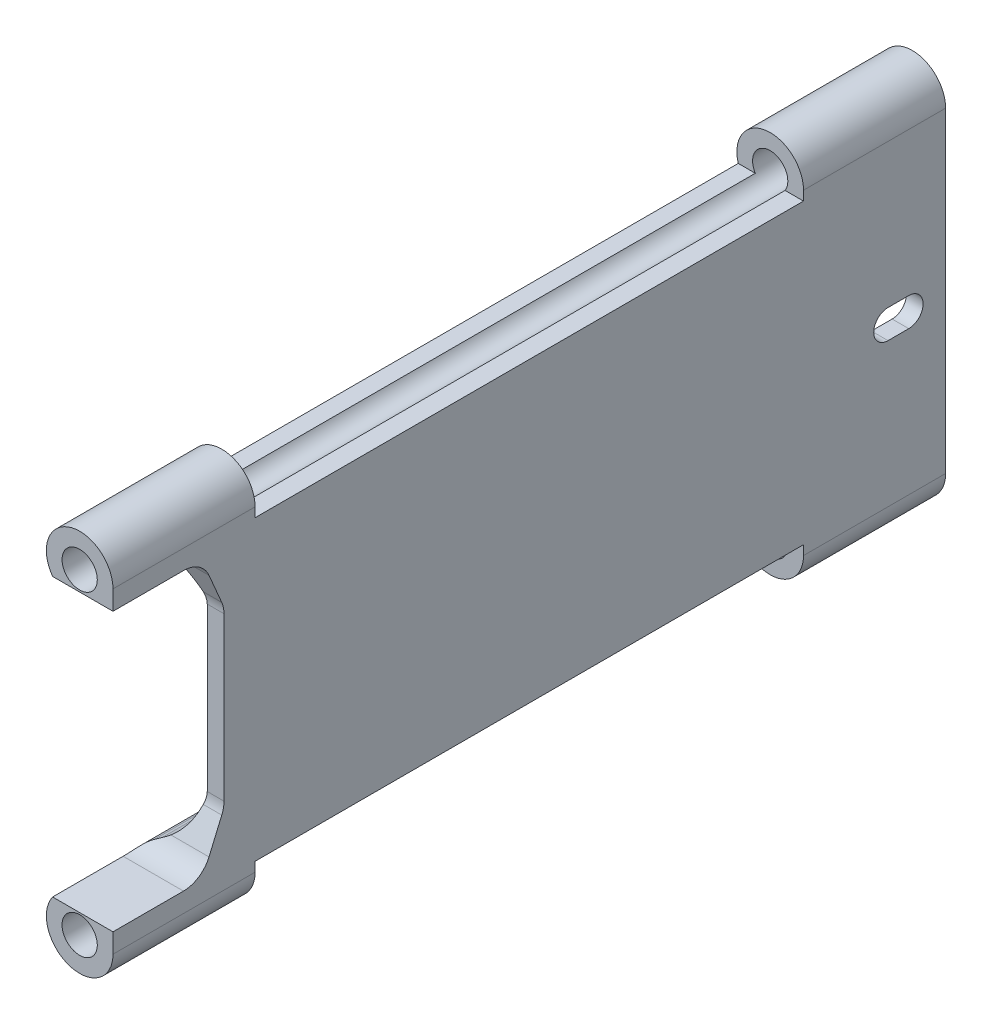
from build123d import *

# Parameters (mm, degrees)
CROQUIS1_R              = 3.175
SALIENTE_EXTRUIR1_DEPTH = 150
REDONDEO1_R             = 10
CORTAR_EXTRUIR1_DEPTH   = 155.383451186
REDONDEO2_R             = 5
CROQUIS3_W              = 98.791812306
CROQUIS3_H              = 18.145434914
CORTAR_EXTRUIR2_DEPTH   = 155.383451313
CORTAR_EXTRUIR3_DEPTH   = 155.179278889


with BuildPart() as part:
    # Croquis1 → Saliente-Extruir1 (new body)
    with BuildSketch(Plane.XY):
        with BuildLine():
            Line((-3, 19.859827637), (-8.98691391, 23.296314259))
            ThreePointArc((-8.98691391, 23.296314259), (-9.006535925, 33.69237342), (0, 28.5))
            Line((0, 28.5), (0, -28.5))
            ThreePointArc((0, -28.5), (-9.006535925, -33.69237342), (-8.98691391, -23.296314259))
            Line((-8.98691391, -23.296314259), (-3, -19.859827637))
            Line((-3, -19.859827637), (-3, 19.859827637))
        make_face()
        with Locations((-6, 28.5)):
            Circle(CROQUIS1_R, mode=Mode.SUBTRACT)
        with Locations(Location((-6, -28.5, 0), (0, 0, 180))):
            Circle(CROQUIS1_R, mode=Mode.SUBTRACT)
    extrude(amount=-SALIENTE_EXTRUIR1_DEPTH)

    # Redondeo1
    redondeo1_edges = [part.edges().sort_by_distance(p)[0] for p in [
        (-3, -19.859827637, -75),
        (-3, 19.859827637, -75),
    ]]
    fillet(redondeo1_edges, radius=REDONDEO1_R)

    # Croquis2 → Cortar-Extruir1 (cut, through all)
    with BuildSketch(Plane(origin=(0, 0, 0), x_dir=(0, 0, -1), z_dir=(1, 0, 0))):
        Polygon((16, 25), (20, 15.646846929), (20, -15.646846929), (16, -25), (-29.873538988, -25), (-29.873538988, 25), align=None)
    extrude(amount=-CORTAR_EXTRUIR1_DEPTH, mode=Mode.SUBTRACT)

    # Redondeo2
    redondeo2_edges = [part.edges().sort_by_distance(p)[0] for p in [
        (-1.562589533, 15.646846929, -20),
        (-1.562589533, -15.646846929, -20),
        (-5.436698586, -25, -16),
        (-5.436698586, 25, -16),
    ]]
    fillet(redondeo2_edges, radius=REDONDEO2_R)

    # Croquis3 → Cortar-Extruir2 (cut, through all)
    with BuildSketch(Plane(origin=(0, 0, 0), x_dir=(0, 0, -1), z_dir=(1, 0, 0))):
        with Locations((75, 35.875128035)):
            Rectangle(CROQUIS3_W, CROQUIS3_H)
        with Locations((75, -35.875128035)):
            Rectangle(CROQUIS3_W, CROQUIS3_H)
    extrude(amount=-CORTAR_EXTRUIR2_DEPTH, mode=Mode.SUBTRACT)

    # Croquis4 → Cortar-Extruir3 (cut, through all)
    with BuildSketch(Plane.ZY.offset(3)):
        with BuildLine():
            Line((-143.359821197, 2.579074159), (-139.627206237, 2.579074159))
            ThreePointArc((-139.627206237, 2.579074159), (-137.048132079, 0), (-139.627206237, -2.579074159))
            Line((-139.627206237, -2.579074159), (-143.359821197, -2.579074159))
            ThreePointArc((-143.359821197, -2.579074159), (-145.938895356, 0), (-143.359821197, 2.579074159))
        make_face()
    extrude(amount=-CORTAR_EXTRUIR3_DEPTH, mode=Mode.SUBTRACT)


solid = part.part
